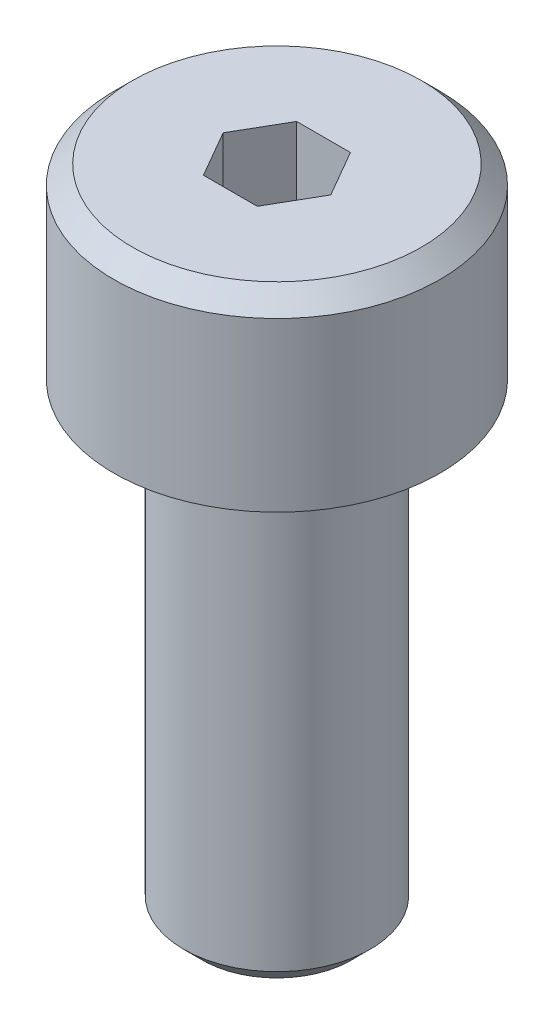
from build123d import *

# Parameters (mm, degrees)
CHAMFER1_SIZE      = 0.4
CUT_EXTRUDE2_DEPTH = 4


with BuildPart() as part:
    # Sketch2 → Revolve1 (revolve)
    with BuildSketch(Plane.XY, mode=Mode.PRIVATE) as revolve1_sk:
        Polygon((0, 14), (3.5, 14), (3.5, 10), (2, 10), (2, 0), (0, 0), align=None)
    revolve(revolve1_sk.sketch.rotate(Axis((0, 0, 0), (0, 1, 0)), 90), axis=Axis((0, 0, 0), (0, 1, 0)))

    # Chamfer1
    chamfer1_edges = [part.edges().sort_by_distance(p)[0] for p in [
        (0, 0, 2),
        (0, 14, 3.5),
    ]]
    chamfer(chamfer1_edges, length=CHAMFER1_SIZE)

    # Sketch4 → Cut-Extrude2 (cut)
    with BuildSketch(Plane(origin=(0, 14, 0), x_dir=(1, 0, 0), z_dir=(0, 1, 0))):
        Polygon((1.154700538, 0), (0.577350269, 1), (-0.577350269, 1), (-1.154700538, 0), (-0.577350269, -1), (0.577350269, -1), align=None)
    extrude(amount=-CUT_EXTRUDE2_DEPTH, mode=Mode.SUBTRACT)


solid = part.part
